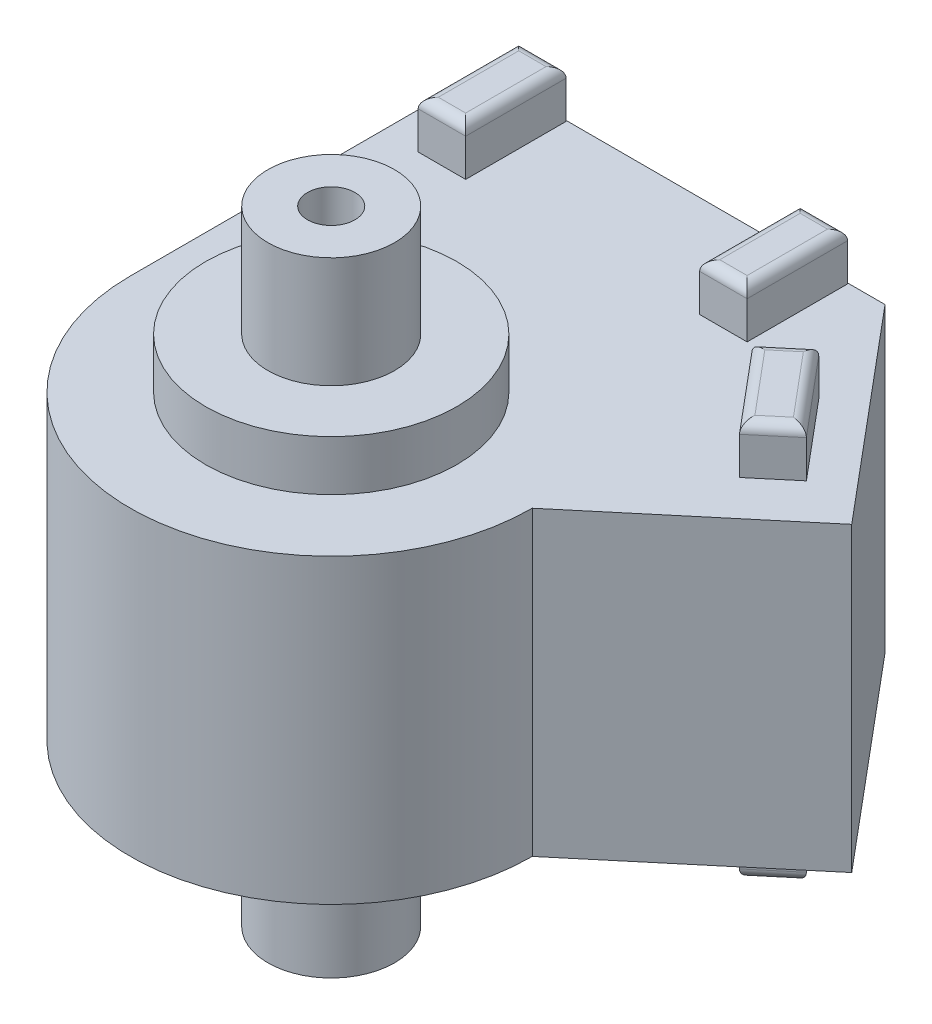
from build123d import *

# Parameters (mm, degrees)
BOSS_EXTRUDE1_DEPTH  = 19.05
SKETCH3_R            = 1.4986
CUT_EXTRUDE1_DEPTH   = 52.081415314
BOSS_EXTRUDE2_DEPTH  = 2.9972
SKETCH5_W            = 2.9972
SKETCH5_H            = 6.35
BOSS_EXTRUDE3_DEPTH  = 2.9972
FILLET1_R            = 0.635
FILLET1_OF_MIRROR1_R = 0.635


with BuildPart() as part:
    # Sketch1 → Revolve1 (revolve)
    with BuildSketch(Plane.XY, mode=Mode.PRIVATE) as revolve1_sk:
        Polygon((-4, -19.7), (0, -19.7), (0, 19.7), (-4, 19.7), (-4, 12.7), (-7.9375, 12.7), (-7.9375, 9.525), (-12.7, 9.525), (-12.7, -9.525), (-7.9375, -9.525), (-7.9375, -12.7), (-4, -12.7), align=None)
    revolve(revolve1_sk.sketch.rotate(Axis((0, 0, 0), (0, 1, 0)), 180), axis=Axis((0, 0, 0), (0, 1, 0)))

    # Sketch2 → Boss-Extrude1 (add)
    with BuildSketch(Plane(origin=(0, 9.525, 0), x_dir=(1, 0, 0), z_dir=(0, 1, 0))):
        Polygon((12.7, 0), (23.672555951, 9.207067652), (12.7, 22.283650626), (-12.7, 22.283650626), (-12.7, 0), align=None)
    extrude(amount=-BOSS_EXTRUDE1_DEPTH)

    # Sketch3 → Cut-Extrude1 (cut, through all)
    with BuildSketch(Plane(origin=(0, 19.7, 0), x_dir=(1, 0, 0), z_dir=(0, 1, 0))):
        with Locations(Location((0, 0, 0), (0, 0, 180))):
            Circle(SKETCH3_R)
    extrude(amount=-CUT_EXTRUDE1_DEPTH, mode=Mode.SUBTRACT)

    # Sketch4 → Boss-Extrude2 (add)
    with BuildSketch(Plane(origin=(0, 9.525, 0), x_dir=(1, 0, 0), z_dir=(0, 1, 0))):
        Polygon((15.779368843, 15.017901691), (13.483380438, 13.091338668), (17.56508176, 8.226956454), (19.861070165, 10.153519478), align=None)
    boss_extrude2 = extrude(amount=BOSS_EXTRUDE2_DEPTH)

    # Sketch5 → Boss-Extrude3 (add)
    with BuildSketch(Plane(origin=(0, 9.525, 0), x_dir=(1, 0, 0), z_dir=(0, 1, 0))):
        with Locations((-8.89, 19.057850626)):
            Rectangle(SKETCH5_W, SKETCH5_H)
        with Locations((8.89, 19.057850626)):
            Rectangle(SKETCH5_W, SKETCH5_H)
    boss_extrude3 = extrude(amount=BOSS_EXTRUDE3_DEPTH)

    # Fillet1
    fillet1_edges = [part.edges().sort_by_distance(p)[0] for p in [
        (-7.3914, 12.5222, -19.057850626),
        (-8.89, 12.5222, -22.232850626),
        (-10.3886, 12.5222, -19.057850626),
        (-8.89, 12.5222, -15.882850626),
        (10.3886, 12.5222, -19.057850626),
        (8.89, 12.5222, -22.232850626),
        (7.3914, 12.5222, -19.057850626),
        (8.89, 12.5222, -15.882850626),
        (17.820219504, 12.5222, -12.585710584),
        (14.631374641, 12.5222, -14.054620179),
        (15.524231099, 12.5222, -10.659147561),
        (18.713075962, 12.5222, -9.190237966),
    ]]
    fillet(fillet1_edges, radius=FILLET1_R)

    # Mirror1: Boss-Extrude2, Boss-Extrude3 across plane
    add(boss_extrude2.mirror(Plane.ZX))
    add(boss_extrude3.mirror(Plane.ZX))

    # Fillet1 of Mirror1
    fillet1_of_mirror1_edges = [part.edges().sort_by_distance(p)[0] for p in [
        (-7.3914, -12.5222, -19.057850626),
        (-8.89, -12.5222, -22.232850626),
        (-10.3886, -12.5222, -19.057850626),
        (-8.89, -12.5222, -15.882850626),
        (10.3886, -12.5222, -19.057850626),
        (8.89, -12.5222, -22.232850626),
        (7.3914, -12.5222, -19.057850626),
        (8.89, -12.5222, -15.882850626),
        (17.820219504, -12.5222, -12.585710584),
        (14.631374641, -12.5222, -14.054620179),
        (15.524231099, -12.5222, -10.659147561),
        (18.713075962, -12.5222, -9.190237966),
    ]]
    fillet(fillet1_of_mirror1_edges, radius=FILLET1_OF_MIRROR1_R)


solid = part.part
